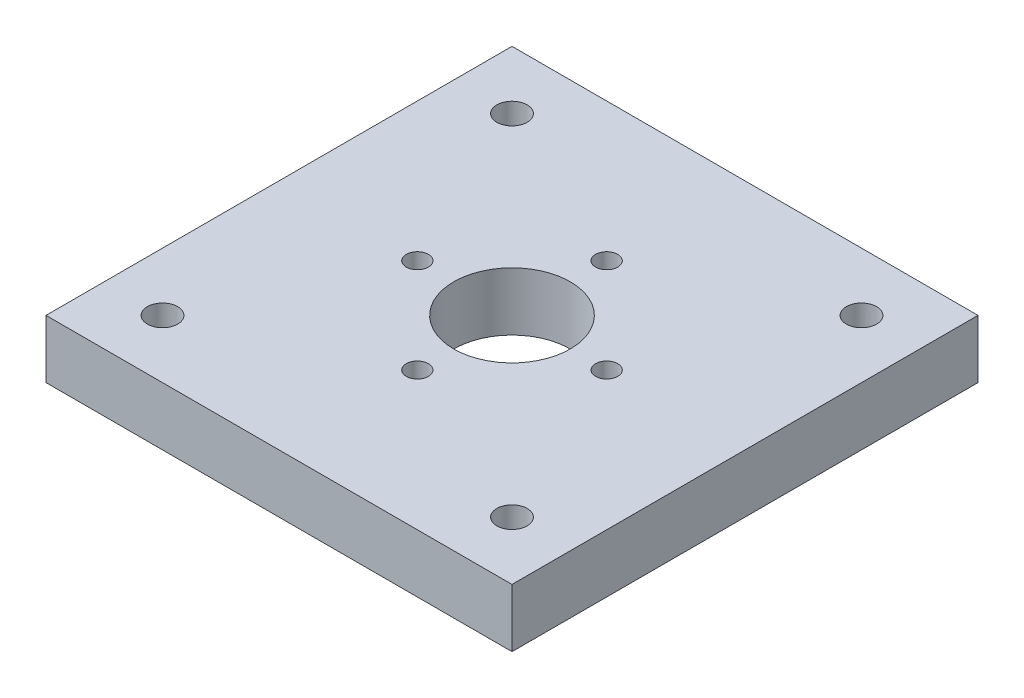
from build123d import *

# Parameters (mm, degrees)
SKETCH1_W           = 4
SKETCH1_H           = 4
SKETCH1_R           = 0.13
SKETCH1_R_2         = 0.5
SKETCH1_R_3         = 0.095
BOSS_EXTRUDE1_DEPTH = 0.5


with BuildPart() as part:
    # Sketch1 → Boss-Extrude1 (new body)
    with BuildSketch(Plane(origin=(0, 0, 0), x_dir=(1, 0, 0), z_dir=(0, 1, 0))):
        Rectangle(SKETCH1_W, SKETCH1_H)
        with Locations(Location((-1.5, 1.5, 0), (0, 0, 270))):
            Circle(SKETCH1_R, mode=Mode.SUBTRACT)
        with Locations(Location((-1.5, -1.5, 0), (0, 0, 270))):
            Circle(SKETCH1_R, mode=Mode.SUBTRACT)
        with Locations(Location((1.5, -1.5, 0), (0, 0, 90))):
            Circle(SKETCH1_R, mode=Mode.SUBTRACT)
        with Locations(Location((1.5, 1.5, 0), (0, 0, 90))):
            Circle(SKETCH1_R, mode=Mode.SUBTRACT)
        with Locations(Location((0, 0, 0), (0, 0, 270))):
            Circle(SKETCH1_R_2, mode=Mode.SUBTRACT)
        with Locations(Location((0, 0.8125, 0), (0, 0, 270))):
            Circle(SKETCH1_R_3, mode=Mode.SUBTRACT)
        with Locations(Location((0.8125, 0, 0), (0, 0, 270))):
            Circle(SKETCH1_R_3, mode=Mode.SUBTRACT)
        with Locations(Location((0, -0.8125, 0), (0, 0, 270))):
            Circle(SKETCH1_R_3, mode=Mode.SUBTRACT)
        with Locations(Location((-0.8125, 0, 0), (0, 0, 270))):
            Circle(SKETCH1_R_3, mode=Mode.SUBTRACT)
    extrude(amount=BOSS_EXTRUDE1_DEPTH)


solid = part.part
